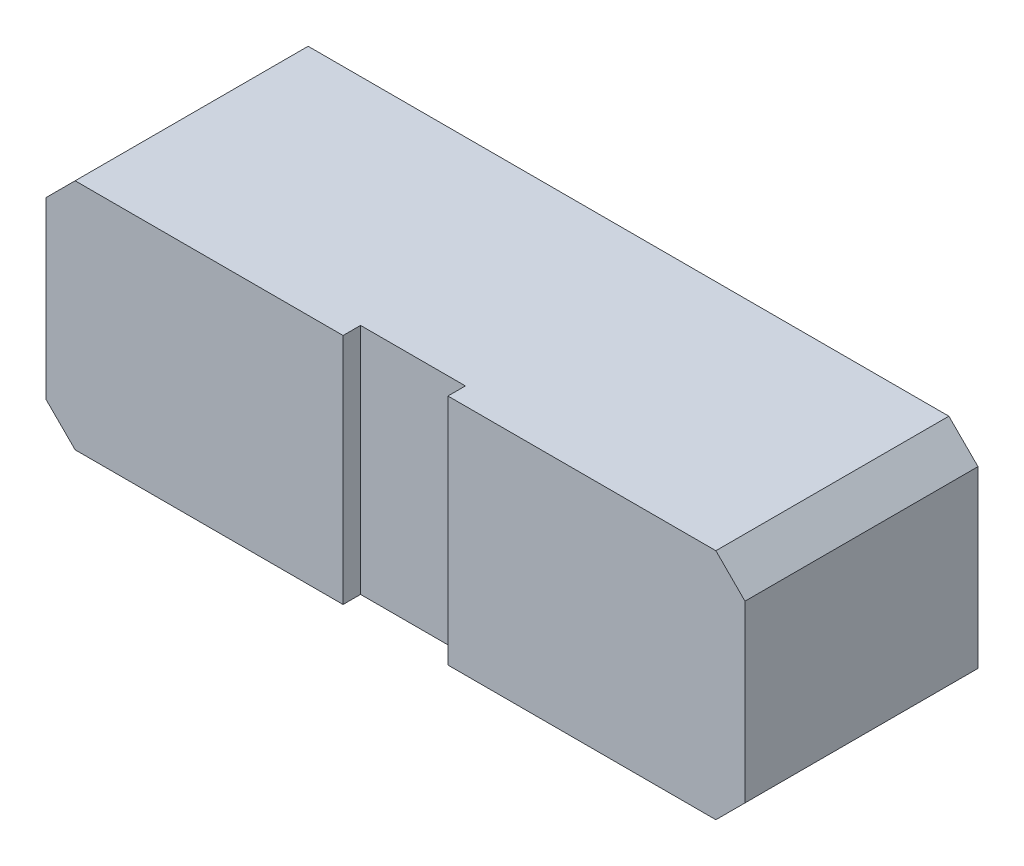
from build123d import *

# Parameters (mm, degrees)
SKETCH_1_W          = 120
SKETCH_1_H          = 40
EXTRUDE_1_DEPTH     = 20
SKETCH_2_W          = 18
SKETCH_2_H          = 40
CUT_EXTRUDE_1_DEPTH = 3
CHAMFER_1_SIZE      = 5


with BuildPart() as part:
    # 草图1 → 凸台-拉伸1 (new, symmetric)
    with BuildSketch(Plane.XY):
        Rectangle(SKETCH_1_W, SKETCH_1_H)
    extrude(amount=EXTRUDE_1_DEPTH, both=True)

    # 草图2 → 切除-拉伸1 (cut)
    with BuildSketch(Plane.XY.offset(20)):
        Rectangle(SKETCH_2_W, SKETCH_2_H)
    extrude(amount=-CUT_EXTRUDE_1_DEPTH, mode=Mode.SUBTRACT)

    # 倒角1
    chamfer_1_edges = [part.edges().sort_by_distance(p)[0] for p in [
        (60, -20, 0),
        (-60, -20, 0),
        (-60, 20, 0),
        (60, 20, 0),
    ]]
    chamfer(chamfer_1_edges, length=CHAMFER_1_SIZE)


solid = part.part
